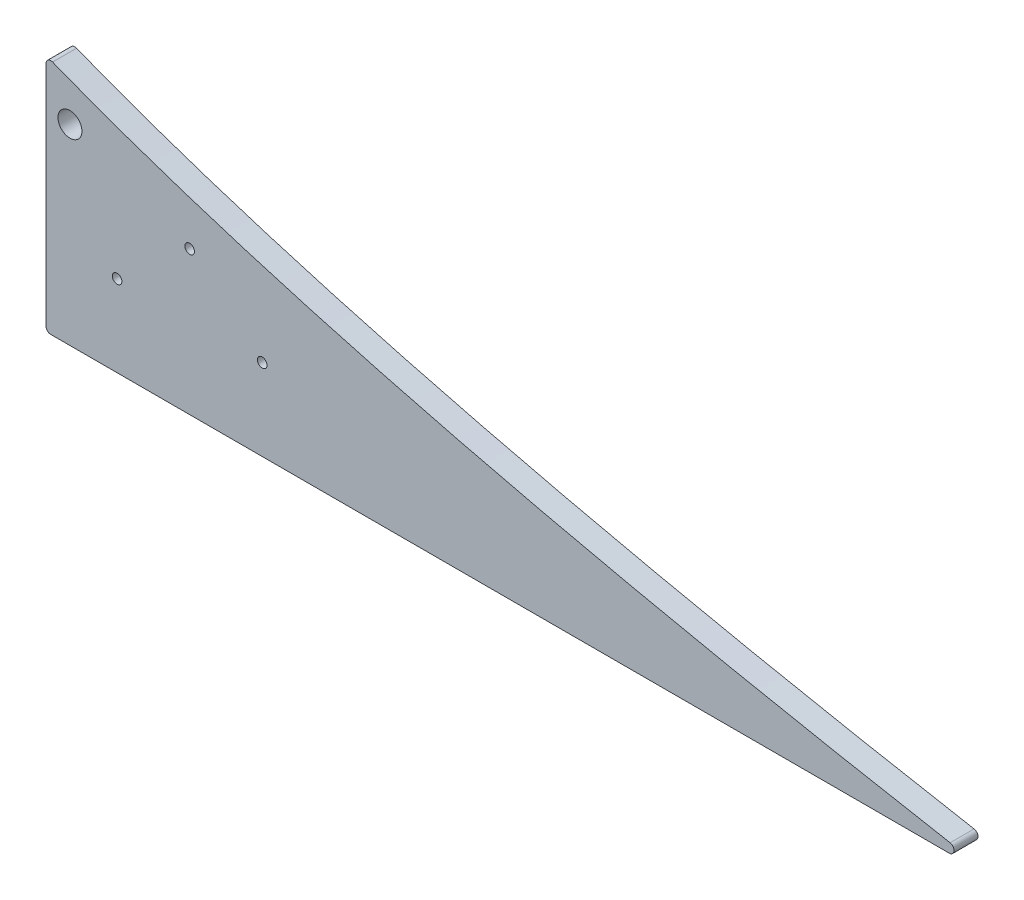
from build123d import *

# Parameters (mm, degrees)
SKETCH1_R           = 6.35
BOSS_EXTRUDE1_DEPTH = 12.7
FILLET1_R           = 2.54
FILLET2_R           = 2.54
SKETCH2_R           = 2.54
CUT_EXTRUDE1_DEPTH  = 203.2


with BuildPart() as part:
    # Sketch1 → Boss-Extrude1 (new body)
    with BuildSketch(Plane.XY):
        with BuildLine():
            Line((0, 0), (0, 127))
            add(Edge.make_bspline(
                [(0, 127), (169.846972044, 59.080713691), (508, 0)],
                knots=[0, 0, 0, 1, 1, 1], degree=2))
            Line((508, 0), (0, 0))
        make_face()
        with Locations((12.7, 101.6)):
            Circle(SKETCH1_R, mode=Mode.SUBTRACT)
    extrude(amount=BOSS_EXTRUDE1_DEPTH)

    # Fillet1
    fillet1_edges = [part.edges().sort_by_distance(p)[0] for p in [
        (0, 127, 6.35),
    ]]
    fillet(fillet1_edges, radius=FILLET1_R)

    # Fillet2
    fillet2_edges = [part.edges().sort_by_distance(p)[0] for p in [
        (0, 0, 6.35),
        (508, 0, 6.35),
    ]]
    fillet(fillet2_edges, radius=FILLET2_R)

    # Sketch2 → Cut-Extrude1 (cut)
    with BuildSketch(Plane.XY.offset(12.7)):
        with Locations((76.2, 76.2)):
            Circle(SKETCH2_R)
        with Locations((37.70884, 43.20032)):
            Circle(SKETCH2_R)
        with Locations((114.69116, 43.20032)):
            Circle(SKETCH2_R)
    extrude(amount=-CUT_EXTRUDE1_DEPTH, mode=Mode.SUBTRACT)


solid = part.part
